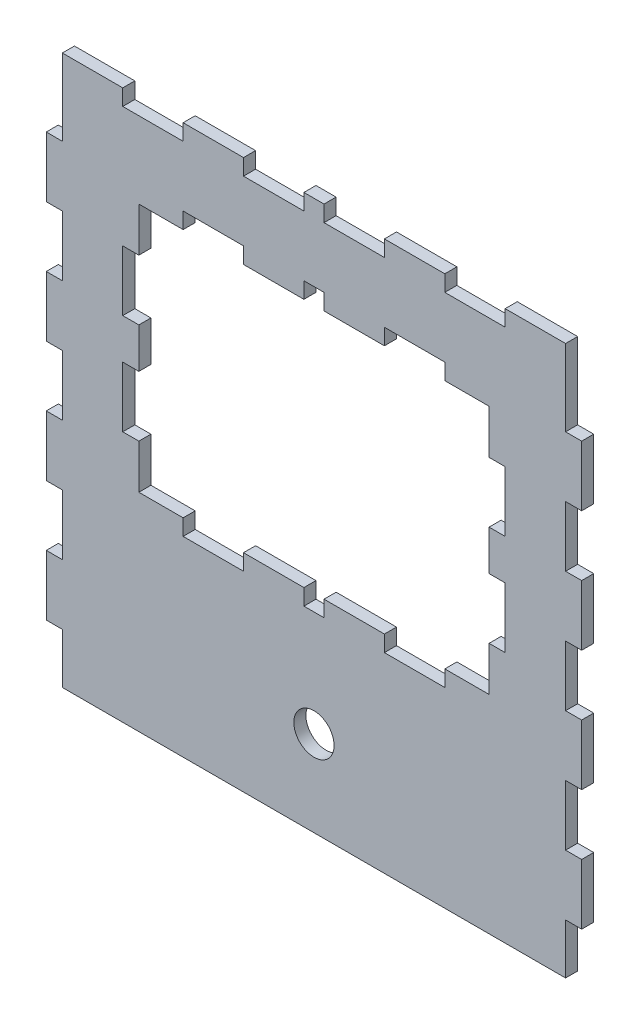
from build123d import *

# Parameters (mm, degrees)
SKETCH1_W           = 125
SKETCH1_H           = 132.5
SKETCH1_W_2         = 95
SKETCH1_H_2         = 70
BOSS_EXTRUDE1_DEPTH = 3
SKETCH2_R           = 5
CUT_EXTRUDE1_DEPTH  = 10
SKETCH3_W           = 5
SKETCH3_H           = 4
SKETCH3_W_2         = 4
SKETCH3_H_2         = 15
SKETCH3_W_3         = 15
BOSS_EXTRUDE2_DEPTH = 3
SKETCH4_W           = 4
SKETCH4_H           = 10
SKETCH4_H_2         = 11
BOSS_EXTRUDE3_DEPTH = 3


with BuildPart() as part:
    # Sketch1 → Boss-Extrude1 (new body)
    with BuildSketch(Plane.XY):
        with Locations((-62.5, 66.25)):
            Rectangle(SKETCH1_W, SKETCH1_H)
        with Locations((-62.5, 82.5)):
            Rectangle(SKETCH1_W_2, SKETCH1_H_2, mode=Mode.SUBTRACT)
    extrude(amount=BOSS_EXTRUDE1_DEPTH)

    # Sketch2 → Cut-Extrude1 (cut)
    with BuildSketch(Plane.XY.offset(3)):
        with Locations((-62.5, 21.25)):
            Circle(SKETCH2_R)
    extrude(amount=-CUT_EXTRUDE1_DEPTH, mode=Mode.SUBTRACT)

    # Sketch3 → Boss-Extrude2 (add)
    with BuildSketch(Plane.XY.offset(3)):
        with Locations((-62.5, 134.5)):
            Rectangle(SKETCH3_W, SKETCH3_H)
        with Locations((2, 20)):
            Rectangle(SKETCH3_W_2, SKETCH3_H_2)
        with Locations((2, 110)):
            Rectangle(SKETCH3_W_2, SKETCH3_H_2)
        with Locations((2, 80)):
            Rectangle(SKETCH3_W_2, SKETCH3_H_2)
        with Locations((2, 50)):
            Rectangle(SKETCH3_W_2, SKETCH3_H_2)
        with Locations((-102.5, 115.5)):
            Rectangle(SKETCH3_W_3, SKETCH3_H)
        with Locations((-127, 80)):
            Rectangle(SKETCH3_W_2, SKETCH3_H_2)
        with Locations((-127, 110)):
            Rectangle(SKETCH3_W_2, SKETCH3_H_2)
        with Locations((-127, 50)):
            Rectangle(SKETCH3_W_2, SKETCH3_H_2)
        with Locations((-127, 20)):
            Rectangle(SKETCH3_W_2, SKETCH3_H_2)
        with Locations((-117.5, 134.5)):
            Rectangle(SKETCH3_W_3, SKETCH3_H)
        with Locations((-7.5, 134.5)):
            Rectangle(SKETCH3_W_3, SKETCH3_H)
        with Locations((-37.5, 134.5)):
            Rectangle(SKETCH3_W_3, SKETCH3_H)
        with Locations((-87.5, 134.5)):
            Rectangle(SKETCH3_W_3, SKETCH3_H)
        with Locations((-22.5, 115.5)):
            Rectangle(SKETCH3_W_3, SKETCH3_H)
        with Locations((-72.5, 115.5)):
            Rectangle(SKETCH3_W_3, SKETCH3_H)
        with Locations((-52.5, 115.5)):
            Rectangle(SKETCH3_W_3, SKETCH3_H)
        with Locations((-52.5, 49.5)):
            Rectangle(SKETCH3_W_3, SKETCH3_H)
        with Locations((-22.5, 49.5)):
            Rectangle(SKETCH3_W_3, SKETCH3_H)
        with Locations((-72.5, 49.5)):
            Rectangle(SKETCH3_W_3, SKETCH3_H)
        with Locations((-102.5, 49.5)):
            Rectangle(SKETCH3_W_3, SKETCH3_H)
    extrude(amount=-BOSS_EXTRUDE2_DEPTH)

    # Sketch4 → Boss-Extrude3 (add)
    with BuildSketch(Plane.XY.offset(3)):
        with Locations((-108, 82.5)):
            Rectangle(SKETCH4_W, SKETCH4_H)
        with Locations((-108, 108)):
            Rectangle(SKETCH4_W, SKETCH4_H_2)
        with Locations((-108, 57)):
            Rectangle(SKETCH4_W, SKETCH4_H_2)
        with Locations((-17, 57)):
            Rectangle(SKETCH4_W, SKETCH4_H_2)
        with Locations((-17, 82.5)):
            Rectangle(SKETCH4_W, SKETCH4_H)
        with Locations((-17, 108)):
            Rectangle(SKETCH4_W, SKETCH4_H_2)
    extrude(amount=-BOSS_EXTRUDE3_DEPTH)


solid = part.part
